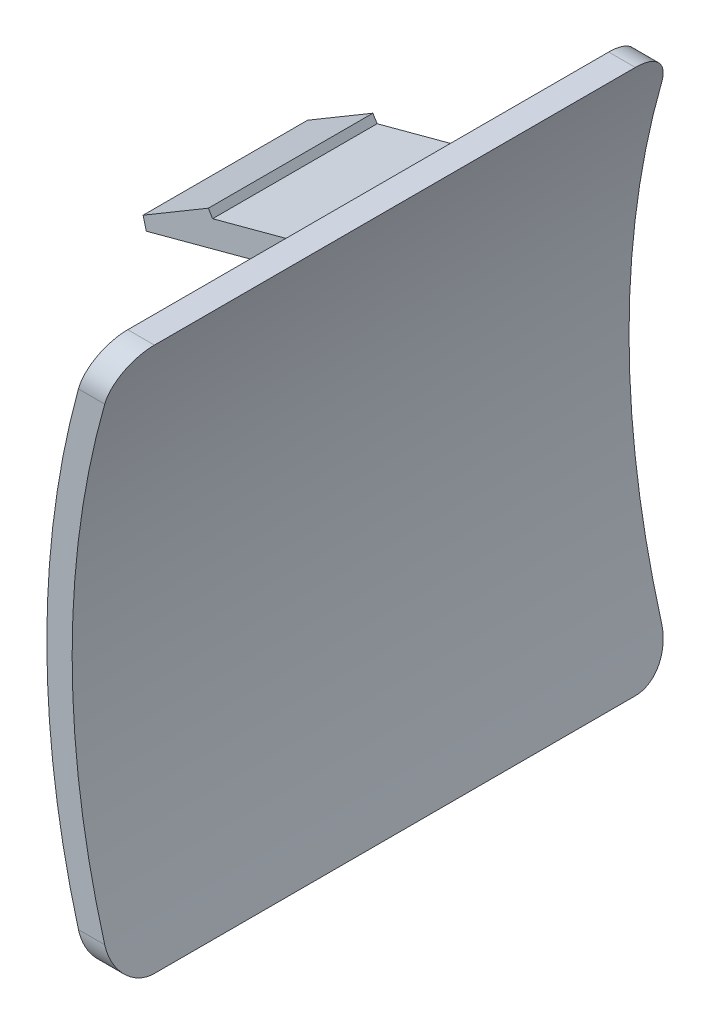
from build123d import *

# Parameters (mm, degrees)
EXTRUDE_1_DEPTH      = 22
EXTRUDE_1_DEPTH_BACK = 22
FILLET_1_R           = 3
EXTRUDE_2_DEPTH      = 6.5
EXTRUDE_2_DEPTH_BACK = 6.5
EXTRUDE_3_DEPTH      = 14
EXTRUDE_3_DEPTH_BACK = 14


with BuildPart() as part:
    # Эскиз1 → Бобышка-Вытянуть1 (new, two sides: drawn at the far end of the back side and taken through both)
    with BuildSketch(Plane.XY.offset(-EXTRUDE_1_DEPTH_BACK)):
        with BuildLine():
            Line((0, 43), (-2.105519461, 43))
            ThreePointArc((-2.105519461, 43), (-5.5, 21.5), (-2.105519461, 0))
            Line((-2.105519461, 0), (0, 0))
            ThreePointArc((0, 0), (-3.5, 21.5), (0, 43))
        make_face()
    extrude(amount=EXTRUDE_1_DEPTH + EXTRUDE_1_DEPTH_BACK)

    # Скругление1
    fillet_1_edges = [part.edges().sort_by_distance(p)[0] for p in [
        (-1.05275973, 0, 22),
        (-1.05275973, 0, -22),
        (-1.05275973, 43, -22),
        (-1.05275973, 43, 22),
    ]]
    fillet(fillet_1_edges, radius=FILLET_1_R)

    # Эскиз2 → Бобышка-Вытянуть2 (add, two sides: drawn at the far end of the back side and taken through both)
    with BuildSketch(Plane.XY.offset(-EXTRUDE_2_DEPTH_BACK)):
        Polygon((-2.105519461, 43), (-7.901074418, 41.447085729), (-8.237011137, 42), (-13.397493305, 38.939048547), (-13.13867426, 37.973122721), (-2.793911065, 40.744993665), align=None)
    extrude(amount=EXTRUDE_2_DEPTH + EXTRUDE_2_DEPTH_BACK)

    # Эскиз3 → Бобышка-Вытянуть3 (add, two sides: drawn at the far end of the back side and taken through both)
    with BuildSketch(Plane.XY.offset(-EXTRUDE_3_DEPTH_BACK)):
        Polygon((-2.105519461, 0), (-8, 0), (-8, -6), (-10, -6), (-10, 2), (-2.72022514, 2), align=None)
    extrude(amount=EXTRUDE_3_DEPTH + EXTRUDE_3_DEPTH_BACK)


solid = part.part
